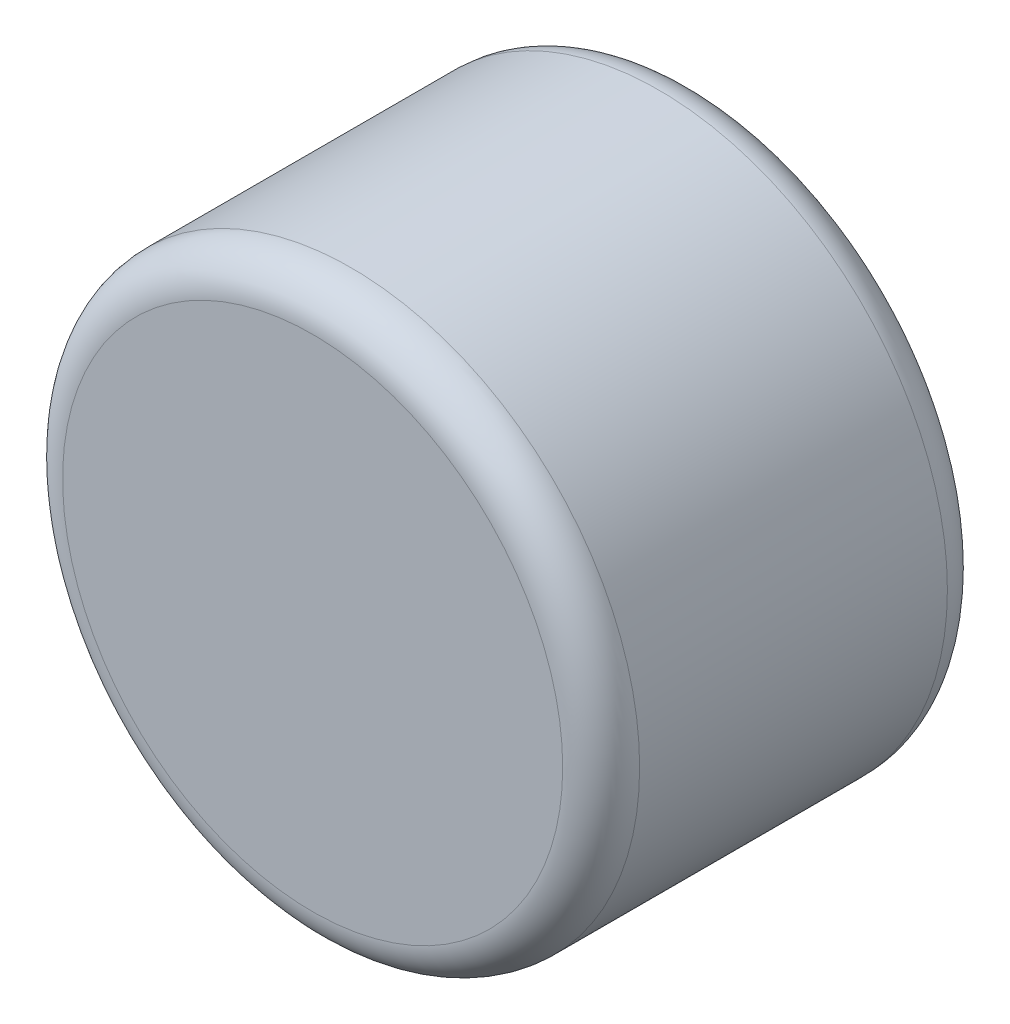
from build123d import *

# Parameters (mm, degrees)
SKETCH_1_R      = 1.5
EXTRUDE_1_DEPTH = 2
FILLET_1_R      = 0.2


with BuildPart() as part:
    # Эскиз1 → Бобышка-Вытянуть1 (new body)
    with BuildSketch(Plane.XY):
        Circle(SKETCH_1_R)
    extrude(amount=EXTRUDE_1_DEPTH)

    # Скругление1
    fillet_1_edges = [part.edges().sort_by_distance(p)[0] for p in [
        (-1.5, 0, 0),
        (-1.5, 0, 2),
    ]]
    fillet(fillet_1_edges, radius=FILLET_1_R)


solid = part.part
